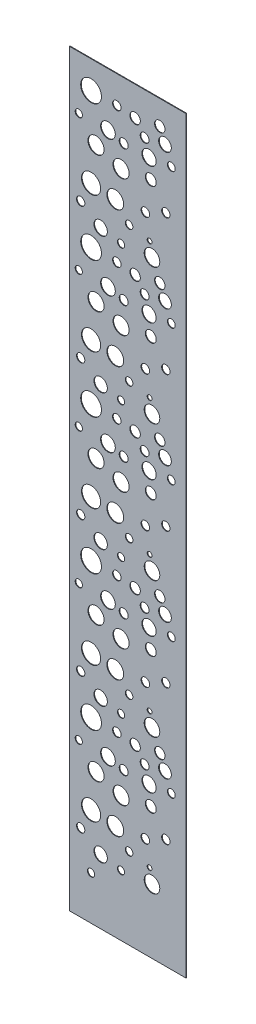
from build123d import *

# Parameters (mm, degrees)
SKETCH1_W           = 609.6
SKETCH1_H           = 3924.3
SKETCH1_R           = 54.398163725
SKETCH1_R_2         = 22.174334182
SKETCH1_R_3         = 27.298100577
SKETCH1_R_4         = 23.227252663
SKETCH1_R_5         = 37.173592689
SKETCH1_R_6         = 28.590875588
SKETCH1_R_7         = 42.206165975
SKETCH1_R_8         = 38.486955553
SKETCH1_R_9         = 50.180146442
SKETCH1_R_10        = 43.975555002
SKETCH1_R_11        = 22.274121471
SKETCH1_R_12        = 21.818074223
SKETCH1_R_13        = 18.751614129
SKETCH1_R_14        = 35.128965843
SKETCH1_R_15        = 19.733457315
SKETCH1_R_16        = 12.577792841
SKETCH1_R_17        = 40.835578512
SKETCH1_R_18        = 21.718097181
SKETCH1_R_19        = 18.929801315
SKETCH1_R_20        = 33.255196606
SKETCH1_R_21        = 20.429884133
SKETCH1_R_22        = 23.463802982
SKETCH1_R_23        = 19.064933431
BOSS_EXTRUDE1_DEPTH = 3.175


with BuildPart() as part:
    # Sketch1 → Boss-Extrude1 (new body)
    with BuildSketch(Plane.XY):
        with Locations((304.8, 1962.15)):
            Rectangle(SKETCH1_W, SKETCH1_H)
        with Locations((112.851024285, 3779.674786899)):
            Circle(SKETCH1_R, mode=Mode.SUBTRACT)
        with Locations((247.795351501, 3779.674786899)):
            Circle(SKETCH1_R_2, mode=Mode.SUBTRACT)
        with Locations((343.69342105, 3769.977995112)):
            Circle(SKETCH1_R_3, mode=Mode.SUBTRACT)
        with Locations((393.504072939, 3706.168654477)):
            Circle(SKETCH1_R_4, mode=Mode.SUBTRACT)
        with Locations((416.731325603, 3628.462528208)):
            Circle(SKETCH1_R_5, mode=Mode.SUBTRACT)
        with Locations((425.860400415, 3531.962655593)):
            Circle(SKETCH1_R_6, mode=Mode.SUBTRACT)
        with Locations((269.969685682, 3503.371780004)):
            Circle(SKETCH1_R_7, mode=Mode.SUBTRACT)
        with Locations((201.284968422, 3644.579490112)):
            Circle(SKETCH1_R_8, mode=Mode.SUBTRACT)
        with Locations((138.803371241, 3545.577945979)):
            Circle(SKETCH1_R_7, mode=Mode.SUBTRACT)
        with Locations((112.851024285, 3359.419490693)):
            Circle(SKETCH1_R_9, mode=Mode.SUBTRACT)
        with Locations((239.771923975, 3349.547720469)):
            Circle(SKETCH1_R_10, mode=Mode.SUBTRACT)
        with Locations((397.269524827, 3370.253455703)):
            Circle(SKETCH1_R_11, mode=Mode.SUBTRACT)
        with Locations((504.703515991, 3421.235355236)):
            Circle(SKETCH1_R_12, mode=Mode.SUBTRACT)
        with Locations((269.969685682, 3163.347301384)):
            Circle(SKETCH1_R_13, mode=Mode.SUBTRACT)
        with Locations((163.031170727, 3182.098915513)):
            Circle(SKETCH1_R_14, mode=Mode.SUBTRACT)
        with Locations((312.175851657, 3270.198437708)):
            Circle(SKETCH1_R_15, mode=Mode.SUBTRACT)
        with Locations((419.543646298, 3250.464980393)):
            Circle(SKETCH1_R_16, mode=Mode.SUBTRACT)
        with Locations((432.121439138, 3182.098915513)):
            Circle(SKETCH1_R_17, mode=Mode.SUBTRACT)
        with Locations((58.45286056, 3250.464980393)):
            Circle(SKETCH1_R_18, mode=Mode.SUBTRACT)
        with Locations((48.524068247, 3644.579490112)):
            Circle(SKETCH1_R_19, mode=Mode.SUBTRACT)
        with Locations((472.95701765, 3797.276095688)):
            Circle(SKETCH1_R_3, mode=Mode.SUBTRACT)
        with Locations((500.255118227, 3729.395907141)):
            Circle(SKETCH1_R_20, mode=Mode.SUBTRACT)
        with Locations((533.510314834, 3644.579490112)):
            Circle(SKETCH1_R_21, mode=Mode.SUBTRACT)
        with Locations((283.747478977, 3625.649688797)):
            Circle(SKETCH1_R_22, mode=Mode.SUBTRACT)
        with Locations((112.851024285, 3068.474786899)):
            Circle(SKETCH1_R, mode=Mode.SUBTRACT)
        with Locations((247.795351501, 3068.474786899)):
            Circle(SKETCH1_R_2, mode=Mode.SUBTRACT)
        with Locations((343.69342105, 3058.777995112)):
            Circle(SKETCH1_R_3, mode=Mode.SUBTRACT)
        with Locations((393.504072939, 2994.968654477)):
            Circle(SKETCH1_R_4, mode=Mode.SUBTRACT)
        with Locations((416.731325603, 2917.262528208)):
            Circle(SKETCH1_R_5, mode=Mode.SUBTRACT)
        with Locations((425.860400415, 2820.762655593)):
            Circle(SKETCH1_R_6, mode=Mode.SUBTRACT)
        with Locations((269.969685682, 2792.171780004)):
            Circle(SKETCH1_R_7, mode=Mode.SUBTRACT)
        with Locations((201.284968422, 2933.379490112)):
            Circle(SKETCH1_R_8, mode=Mode.SUBTRACT)
        with Locations((138.803371241, 2834.377945979)):
            Circle(SKETCH1_R_7, mode=Mode.SUBTRACT)
        with Locations((112.851024285, 2648.219490693)):
            Circle(SKETCH1_R_9, mode=Mode.SUBTRACT)
        with Locations((239.771923975, 2638.347720469)):
            Circle(SKETCH1_R_10, mode=Mode.SUBTRACT)
        with Locations((397.269524827, 2659.053455703)):
            Circle(SKETCH1_R_11, mode=Mode.SUBTRACT)
        with Locations((504.703515991, 2710.035355236)):
            Circle(SKETCH1_R_12, mode=Mode.SUBTRACT)
        with Locations((269.969685682, 2452.147301384)):
            Circle(SKETCH1_R_13, mode=Mode.SUBTRACT)
        with Locations((163.031170727, 2470.898915513)):
            Circle(SKETCH1_R_14, mode=Mode.SUBTRACT)
        with Locations((312.175851657, 2558.998437708)):
            Circle(SKETCH1_R_15, mode=Mode.SUBTRACT)
        with Locations((419.543646298, 2539.264980393)):
            Circle(SKETCH1_R_16, mode=Mode.SUBTRACT)
        with Locations((432.121439138, 2470.898915513)):
            Circle(SKETCH1_R_17, mode=Mode.SUBTRACT)
        with Locations((58.45286056, 2539.264980393)):
            Circle(SKETCH1_R_18, mode=Mode.SUBTRACT)
        with Locations((48.524068247, 2933.379490112)):
            Circle(SKETCH1_R_19, mode=Mode.SUBTRACT)
        with Locations((472.95701765, 3086.076095688)):
            Circle(SKETCH1_R_3, mode=Mode.SUBTRACT)
        with Locations((500.255118227, 3018.195907141)):
            Circle(SKETCH1_R_20, mode=Mode.SUBTRACT)
        with Locations((533.510314834, 2933.379490112)):
            Circle(SKETCH1_R_21, mode=Mode.SUBTRACT)
        with Locations((283.747478977, 2914.449688797)):
            Circle(SKETCH1_R_22, mode=Mode.SUBTRACT)
        with Locations((112.851024285, 2357.274786899)):
            Circle(SKETCH1_R, mode=Mode.SUBTRACT)
        with Locations((247.795351501, 2357.274786899)):
            Circle(SKETCH1_R_2, mode=Mode.SUBTRACT)
        with Locations((343.69342105, 2347.577995112)):
            Circle(SKETCH1_R_3, mode=Mode.SUBTRACT)
        with Locations((393.504072939, 2283.768654477)):
            Circle(SKETCH1_R_4, mode=Mode.SUBTRACT)
        with Locations((416.731325603, 2206.062528208)):
            Circle(SKETCH1_R_5, mode=Mode.SUBTRACT)
        with Locations((425.860400415, 2109.562655593)):
            Circle(SKETCH1_R_6, mode=Mode.SUBTRACT)
        with Locations((269.969685682, 2080.971780004)):
            Circle(SKETCH1_R_7, mode=Mode.SUBTRACT)
        with Locations((201.284968422, 2222.179490112)):
            Circle(SKETCH1_R_8, mode=Mode.SUBTRACT)
        with Locations((138.803371241, 2123.177945979)):
            Circle(SKETCH1_R_7, mode=Mode.SUBTRACT)
        with Locations((112.851024285, 1937.019490693)):
            Circle(SKETCH1_R_9, mode=Mode.SUBTRACT)
        with Locations((239.771923975, 1927.147720469)):
            Circle(SKETCH1_R_10, mode=Mode.SUBTRACT)
        with Locations((397.269524827, 1947.853455703)):
            Circle(SKETCH1_R_11, mode=Mode.SUBTRACT)
        with Locations((504.703515991, 1998.835355236)):
            Circle(SKETCH1_R_12, mode=Mode.SUBTRACT)
        with Locations((269.969685682, 1740.947301384)):
            Circle(SKETCH1_R_13, mode=Mode.SUBTRACT)
        with Locations((163.031170727, 1759.698915513)):
            Circle(SKETCH1_R_14, mode=Mode.SUBTRACT)
        with Locations((312.175851657, 1847.798437708)):
            Circle(SKETCH1_R_15, mode=Mode.SUBTRACT)
        with Locations((419.543646298, 1828.064980393)):
            Circle(SKETCH1_R_16, mode=Mode.SUBTRACT)
        with Locations((432.121439138, 1759.698915513)):
            Circle(SKETCH1_R_17, mode=Mode.SUBTRACT)
        with Locations((58.45286056, 1828.064980393)):
            Circle(SKETCH1_R_18, mode=Mode.SUBTRACT)
        with Locations((48.524068247, 2222.179490112)):
            Circle(SKETCH1_R_19, mode=Mode.SUBTRACT)
        with Locations((472.95701765, 2374.876095688)):
            Circle(SKETCH1_R_3, mode=Mode.SUBTRACT)
        with Locations((500.255118227, 2306.995907141)):
            Circle(SKETCH1_R_20, mode=Mode.SUBTRACT)
        with Locations((533.510314834, 2222.179490112)):
            Circle(SKETCH1_R_21, mode=Mode.SUBTRACT)
        with Locations((283.747478977, 2203.249688797)):
            Circle(SKETCH1_R_22, mode=Mode.SUBTRACT)
        with Locations((112.851024285, 1646.074786899)):
            Circle(SKETCH1_R, mode=Mode.SUBTRACT)
        with Locations((247.795351501, 1646.074786899)):
            Circle(SKETCH1_R_2, mode=Mode.SUBTRACT)
        with Locations((343.69342105, 1636.377995112)):
            Circle(SKETCH1_R_3, mode=Mode.SUBTRACT)
        with Locations((393.504072939, 1572.568654477)):
            Circle(SKETCH1_R_4, mode=Mode.SUBTRACT)
        with Locations((416.731325603, 1494.862528208)):
            Circle(SKETCH1_R_5, mode=Mode.SUBTRACT)
        with Locations((425.860400415, 1398.362655593)):
            Circle(SKETCH1_R_6, mode=Mode.SUBTRACT)
        with Locations((269.969685682, 1369.771780004)):
            Circle(SKETCH1_R_7, mode=Mode.SUBTRACT)
        with Locations((201.284968422, 1510.979490112)):
            Circle(SKETCH1_R_8, mode=Mode.SUBTRACT)
        with Locations((138.803371241, 1411.977945979)):
            Circle(SKETCH1_R_7, mode=Mode.SUBTRACT)
        with Locations((112.851024285, 1225.819490693)):
            Circle(SKETCH1_R_9, mode=Mode.SUBTRACT)
        with Locations((239.771923975, 1215.947720469)):
            Circle(SKETCH1_R_10, mode=Mode.SUBTRACT)
        with Locations((397.269524827, 1236.653455703)):
            Circle(SKETCH1_R_11, mode=Mode.SUBTRACT)
        with Locations((504.703515991, 1287.635355236)):
            Circle(SKETCH1_R_12, mode=Mode.SUBTRACT)
        with Locations((269.969685682, 1029.747301384)):
            Circle(SKETCH1_R_13, mode=Mode.SUBTRACT)
        with Locations((163.031170727, 1048.498915513)):
            Circle(SKETCH1_R_14, mode=Mode.SUBTRACT)
        with Locations((312.175851657, 1136.598437708)):
            Circle(SKETCH1_R_15, mode=Mode.SUBTRACT)
        with Locations((419.543646298, 1116.864980393)):
            Circle(SKETCH1_R_16, mode=Mode.SUBTRACT)
        with Locations((432.121439138, 1048.498915513)):
            Circle(SKETCH1_R_17, mode=Mode.SUBTRACT)
        with Locations((58.45286056, 1116.864980393)):
            Circle(SKETCH1_R_18, mode=Mode.SUBTRACT)
        with Locations((48.524068247, 1510.979490112)):
            Circle(SKETCH1_R_19, mode=Mode.SUBTRACT)
        with Locations((472.95701765, 1663.676095688)):
            Circle(SKETCH1_R_3, mode=Mode.SUBTRACT)
        with Locations((500.255118227, 1595.795907141)):
            Circle(SKETCH1_R_20, mode=Mode.SUBTRACT)
        with Locations((533.510314834, 1510.979490112)):
            Circle(SKETCH1_R_21, mode=Mode.SUBTRACT)
        with Locations((283.747478977, 1492.049688797)):
            Circle(SKETCH1_R_22, mode=Mode.SUBTRACT)
        with Locations((112.851024285, 934.874786899)):
            Circle(SKETCH1_R, mode=Mode.SUBTRACT)
        with Locations((247.795351501, 934.874786899)):
            Circle(SKETCH1_R_2, mode=Mode.SUBTRACT)
        with Locations((343.69342105, 925.177995112)):
            Circle(SKETCH1_R_3, mode=Mode.SUBTRACT)
        with Locations((393.504072939, 861.368654477)):
            Circle(SKETCH1_R_4, mode=Mode.SUBTRACT)
        with Locations((416.731325603, 783.662528208)):
            Circle(SKETCH1_R_5, mode=Mode.SUBTRACT)
        with Locations((425.860400415, 687.162655593)):
            Circle(SKETCH1_R_6, mode=Mode.SUBTRACT)
        with Locations((269.969685682, 658.571780004)):
            Circle(SKETCH1_R_7, mode=Mode.SUBTRACT)
        with Locations((201.284968422, 799.779490112)):
            Circle(SKETCH1_R_8, mode=Mode.SUBTRACT)
        with Locations((138.803371241, 700.777945979)):
            Circle(SKETCH1_R_7, mode=Mode.SUBTRACT)
        with Locations((112.851024285, 514.619490693)):
            Circle(SKETCH1_R_9, mode=Mode.SUBTRACT)
        with Locations((239.771923975, 504.747720469)):
            Circle(SKETCH1_R_10, mode=Mode.SUBTRACT)
        with Locations((397.269524827, 525.453455703)):
            Circle(SKETCH1_R_11, mode=Mode.SUBTRACT)
        with Locations((504.703515991, 576.435355236)):
            Circle(SKETCH1_R_12, mode=Mode.SUBTRACT)
        with Locations((269.969685682, 318.547301384)):
            Circle(SKETCH1_R_13, mode=Mode.SUBTRACT)
        with Locations((163.031170727, 337.298915513)):
            Circle(SKETCH1_R_14, mode=Mode.SUBTRACT)
        with Locations((312.175851657, 425.398437708)):
            Circle(SKETCH1_R_15, mode=Mode.SUBTRACT)
        with Locations((419.543646298, 405.664980393)):
            Circle(SKETCH1_R_16, mode=Mode.SUBTRACT)
        with Locations((432.121439138, 337.298915513)):
            Circle(SKETCH1_R_17, mode=Mode.SUBTRACT)
        with Locations((112.851024285, 229.592720918)):
            Circle(SKETCH1_R_23, mode=Mode.SUBTRACT)
        with Locations((58.45286056, 405.664980393)):
            Circle(SKETCH1_R_18, mode=Mode.SUBTRACT)
        with Locations((48.524068247, 799.779490112)):
            Circle(SKETCH1_R_19, mode=Mode.SUBTRACT)
        with Locations((472.95701765, 952.476095688)):
            Circle(SKETCH1_R_3, mode=Mode.SUBTRACT)
        with Locations((500.255118227, 884.595907141)):
            Circle(SKETCH1_R_20, mode=Mode.SUBTRACT)
        with Locations((533.510314834, 799.779490112)):
            Circle(SKETCH1_R_21, mode=Mode.SUBTRACT)
        with Locations((283.747478977, 780.849688797)):
            Circle(SKETCH1_R_22, mode=Mode.SUBTRACT)
    extrude(amount=BOSS_EXTRUDE1_DEPTH)


solid = part.part
